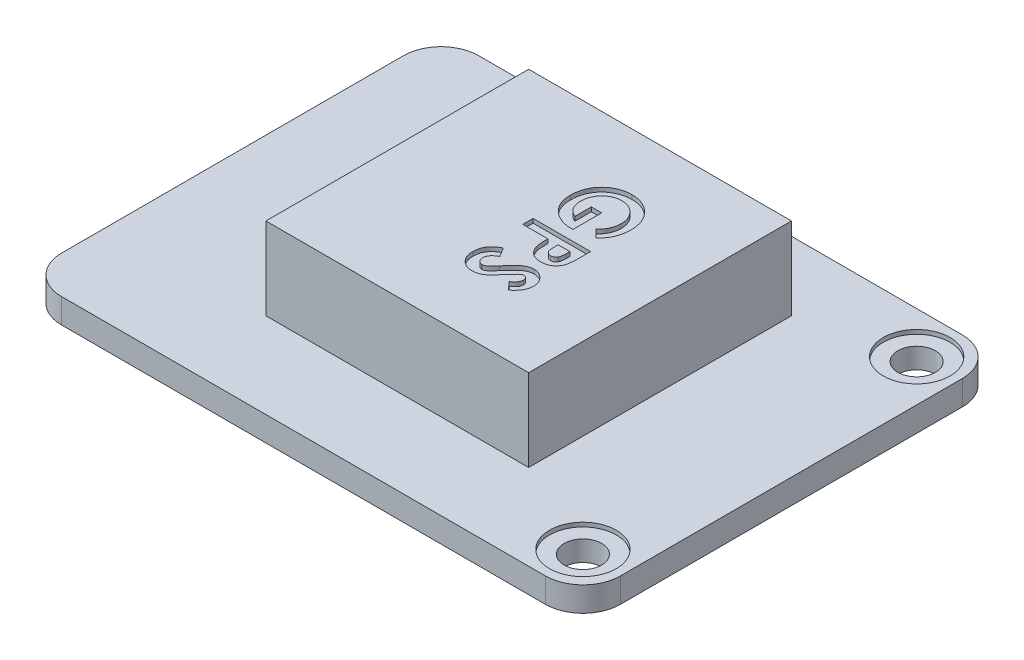
from build123d import *

# Parameters (mm, degrees)
SKETCH1_W           = 34.036
SKETCH1_H           = 25.4
SKETCH1_R           = 1.143
BOSS_EXTRUDE1_DEPTH = 1.5
CUT_EXTRUDE3_START  = -0.254
SKETCH2_R           = 2.032
SKETCH2_R_2         = 1.143
CUT_EXTRUDE3_DEPTH  = 0.254
SKETCH3_W           = 16
SKETCH3_H           = 16
BOSS_EXTRUDE2_DEPTH = 5
CUT_EXTRUDE4_DEPTH  = 0.254
FILLET1_R           = 2.286


with BuildPart() as part:
    # Sketch1 → Boss-Extrude1 (new body)
    with BuildSketch(Plane(origin=(0, 0, 0), x_dir=(1, 0, 0), z_dir=(0, 1, 0))):
        Rectangle(SKETCH1_W, SKETCH1_H)
        with Locations(Location((14.478, 10.16, 0), (0, 0, 270))):
            Circle(SKETCH1_R, mode=Mode.SUBTRACT)
        with Locations(Location((14.478, -10.16, 0), (0, 0, 270))):
            Circle(SKETCH1_R, mode=Mode.SUBTRACT)
    extrude(amount=BOSS_EXTRUDE1_DEPTH)

    # Sketch2 → Cut-Extrude3 (cut)
    # profile 1 of 2: a face of its own
    with BuildSketch(Plane(origin=(0, 1.5, 0), x_dir=(1, 0, 0), z_dir=(0, 1, 0)).offset(CUT_EXTRUDE3_START)):
        with Locations(Location((14.478, 10.16, 0), (0, 0, 270))):
            Circle(SKETCH2_R)
        with Locations(Location((14.478, 10.16, 0), (0, 0, 270))):
            Circle(SKETCH2_R_2, mode=Mode.SUBTRACT)
    # profile 2 of 2: a face of its own
    with BuildSketch(Plane(origin=(0, 1.5, 0), x_dir=(1, 0, 0), z_dir=(0, 1, 0)).offset(CUT_EXTRUDE3_START)):
        with Locations(Location((14.478, -10.16, 0), (0, 0, 270))):
            Circle(SKETCH2_R)
        with Locations(Location((14.478, -10.16, 0), (0, 0, 270))):
            Circle(SKETCH2_R_2, mode=Mode.SUBTRACT)
    extrude(amount=CUT_EXTRUDE3_DEPTH, mode=Mode.SUBTRACT)

    # Sketch3 → Boss-Extrude2 (add)
    with BuildSketch(Plane(origin=(0, 1.5, 0), x_dir=(1, 0, 0), z_dir=(0, 1, 0))):
        with Locations((0.508, 0.508)):
            Rectangle(SKETCH3_W, SKETCH3_H)
    extrude(amount=BOSS_EXTRUDE2_DEPTH)

    # Sketch4 → Cut-Extrude4 (cut)
    # profile 1 of 3: a face of its own
    with BuildSketch(Plane(origin=(0, 6.5, 0), x_dir=(1, 0, 0), z_dir=(0, 1, 0))):
        with BuildLine():
            Line((3.451309295, 1.652931891), (2.99628125, 2.128292468))
            add(Edge.make_bspline(
                [(2.99628125, 2.128292468), (3.03396147, 2.165927594), (3.107896282, 2.239773926), (3.204127521, 2.360540362), (3.285943098, 2.48561774), (3.353217589, 2.615417737), (3.405401533, 2.750121166), (3.442730378, 2.8894622), (3.464870748, 3.033667528), (3.467970324, 3.131288099), (3.469538462, 3.180676282)],
                knots=[0, 0, 0, 0, 1.075575784, 2.110457258, 3.113929901, 4.09197124, 5.059417775, 6.02750972, 7.002078037, 8, 8, 8, 8], degree=3))
            add(Edge.make_bspline(
                [(3.469538462, 3.180676282), (3.468439613, 3.223494281), (3.466281929, 3.307571176), (3.449898411, 3.431114858), (3.422525816, 3.549165409), (3.384621758, 3.662294649), (3.335238241, 3.769760102), (3.275491693, 3.872214844), (3.203887366, 3.968488072), (3.123311995, 4.058991397), (3.034674811, 4.141216945), (2.940619792, 4.213997927), (2.841354788, 4.275134567), (2.737444678, 4.325615086), (2.628684991, 4.363971918), (2.51521909, 4.391367373), (2.397359383, 4.408753263), (2.316954919, 4.410806279), (2.276229167, 4.411846154)],
                knots=[0, 0, 0, 0, 1.075079404, 2.111012651, 3.123248818, 4.114352675, 5.101852729, 6.0883232, 7.087285529, 8.109865155, 9.127328517, 10.119283532, 11.091685968, 12.049813832, 13.015105368, 13.981662908, 14.977689899, 16, 16, 16, 16], degree=3))
            add(Edge.make_bspline(
                [(2.276229167, 4.411846154), (2.234096416, 4.410869458), (2.151089131, 4.408945234), (2.02922704, 4.390687589), (1.912239482, 4.362066988), (1.799990092, 4.32200182), (1.692798007, 4.269771908), (1.59084415, 4.205465367), (1.493676598, 4.130032691), (1.402635336, 4.044129553), (1.318744746, 3.950646798), (1.246328446, 3.849432446), (1.184128268, 3.743644214), (1.134124338, 3.631567859), (1.094911007, 3.514632976), (1.066719758, 3.392098705), (1.049583238, 3.264364278), (1.047512463, 3.177223986), (1.046461538, 3.133)],
                knots=[0, 0, 0, 0, 1.022020332, 2.013519966, 2.983415422, 3.94151226, 4.900448282, 5.871487551, 6.861996943, 7.881274692, 8.905826162, 9.905469932, 10.896823527, 11.879375057, 12.878487611, 13.885682746, 14.926976999, 16, 16, 16, 16], degree=3))
            add(Edge.make_bspline(
                [(1.046461538, 3.133), (1.04672135, 3.104233387), (1.047231417, 3.047758124), (1.055499552, 2.96491676), (1.067337879, 2.885581359), (1.082947298, 2.809413645), (1.105332072, 2.73708419), (1.130663038, 2.667611384), (1.16204701, 2.601907759), (1.197662296, 2.539400703), (1.238681206, 2.480033544), (1.284919264, 2.423998067), (1.336797415, 2.371105646), (1.393321173, 2.320444942), (1.456141465, 2.273735971), (1.523701044, 2.229326529), (1.596748411, 2.187799504), (1.64832762, 2.163259684), (1.674666667, 2.150728365)],
                knots=[0, 0, 0, 0, 1.109467577, 2.178131716, 3.208562196, 4.204278576, 5.174223432, 6.127254264, 7.054993225, 7.9799672, 8.900446918, 9.835649638, 10.779420865, 11.756673556, 12.761211291, 13.796640546, 14.874849225, 16, 16, 16, 16], degree=3))
            Line((1.674666667, 2.150728365), (1.674666667, 3.155435897))
            Line((1.674666667, 3.155435897), (2.302871795, 3.155435897))
            Line((2.302871795, 3.155435897), (2.302871795, 1.41034375))
            Line((2.302871795, 1.41034375), (2.153532853, 1.405435897))
            add(Edge.make_bspline(
                [(2.153532853, 1.405435897), (2.115178823, 1.40606652), (2.03853921, 1.40732664), (1.924435882, 1.418842812), (1.811845899, 1.437919175), (1.700882342, 1.46399839), (1.591000895, 1.496682244), (1.483253766, 1.538364388), (1.376910248, 1.587173925), (1.272422219, 1.641861548), (1.172163115, 1.703314701), (1.077230978, 1.769478043), (0.987790116, 1.839408372), (0.905086663, 1.914626643), (0.828425875, 1.993961583), (0.758102674, 2.077569364), (0.694057559, 2.165745703), (0.635749495, 2.258023495), (0.584645917, 2.35492835), (0.540192583, 2.455927485), (0.502439306, 2.560868406), (0.471489831, 2.670022046), (0.447609849, 2.783173618), (0.431235314, 2.900325544), (0.420108633, 3.021542168), (0.418881282, 3.103760839), (0.41825641, 3.145620192)],
                knots=[0, 0, 0, 0, 1.006889344, 2.011981806, 3.007738725, 4.003571281, 5.003404394, 6.015442001, 7.03424805, 8.074616296, 9.110249922, 10.119753985, 11.111721717, 12.089233633, 13.052717867, 14.006597561, 14.955430184, 15.912305663, 16.870361111, 17.829300583, 18.807640451, 19.796414044, 20.806216501, 21.841577364, 22.90109906, 24, 24, 24, 24], degree=3))
            add(Edge.make_bspline(
                [(0.41825641, 3.145620192), (0.418879251, 3.190280241), (0.420113906, 3.278809779), (0.431466296, 3.409500295), (0.450659888, 3.536553165), (0.476364726, 3.659769811), (0.509517486, 3.779695085), (0.549722968, 3.895879148), (0.598926031, 4.007900834), (0.653734289, 4.116461444), (0.716490343, 4.220206489), (0.784847206, 4.319189543), (0.860285608, 4.412060136), (0.942034687, 4.499207136), (1.029383669, 4.581249833), (1.1235073, 4.657385346), (1.223496764, 4.728298445), (1.33001661, 4.792252403), (1.440158723, 4.850336314), (1.553274784, 4.900924959), (1.668487902, 4.943810196), (1.785823331, 4.978959535), (1.905278269, 5.00629839), (2.02678022, 5.026141143), (2.150519423, 5.037280894), (2.233673517, 5.03912372), (2.275528045, 5.040051282)],
                knots=[0, 0, 0, 0, 1.084269852, 2.149346245, 3.182248965, 4.202856654, 5.203774155, 6.201646532, 7.185249156, 8.172511953, 9.152555749, 10.126997366, 11.091273046, 12.05486384, 13.026475683, 13.998733638, 14.992239644, 16.000514163, 17.013329872, 18.014183023, 19.007154045, 19.996420909, 20.986208491, 21.980735032, 22.983629316, 24, 24, 24, 24], degree=3))
            add(Edge.make_bspline(
                [(2.275528045, 5.040051282), (2.332627147, 5.038811016), (2.445380945, 5.036361857), (2.611468005, 5.013678932), (2.772140663, 4.978319631), (2.926813761, 4.927575474), (3.075700363, 4.862458738), (3.219149986, 4.78389186), (3.357010157, 4.690168198), (3.44236475, 4.617619646), (3.485664263, 4.580816506)],
                knots=[0, 0, 0, 0, 1.034044851, 2.041932006, 3.031217818, 4.011390712, 4.986069675, 5.97149666, 6.970960976, 8, 8, 8, 8], degree=3))
            add(Edge.make_bspline(
                [(3.485664263, 4.580816506), (3.510714344, 4.557965797), (3.560438377, 4.512607482), (3.629530933, 4.440102298), (3.694480492, 4.365758362), (3.753909839, 4.288545999), (3.809119911, 4.2088711), (3.859075751, 4.126504347), (3.90536798, 4.041877816), (3.945632741, 3.954331523), (3.981733458, 3.864323786), (4.012279741, 3.771455973), (4.039336486, 3.676423646), (4.059919731, 3.57838529), (4.077059886, 3.478331326), (4.088548115, 3.375551539), (4.096968169, 3.270326009), (4.097483072, 3.199156753), (4.09774359, 3.163148237)],
                knots=[0, 0, 0, 0, 1.020590567, 2.025856924, 3.013483481, 3.991664875, 4.957826714, 5.930500614, 6.890802512, 7.860442893, 8.829981142, 9.809047939, 10.802672283, 11.803273349, 12.823572789, 13.857849586, 14.916166035, 16, 16, 16, 16], degree=3))
            add(Edge.make_bspline(
                [(4.09774359, 3.163148237), (4.097163107, 3.125507647), (4.09600816, 3.050616695), (4.088016678, 2.939266251), (4.075687706, 2.829463096), (4.057193543, 2.721669951), (4.034386391, 2.615525062), (4.005164785, 2.511577861), (3.971963776, 2.40915022), (3.945493479, 2.342470214), (3.932278846, 2.309181891)],
                knots=[0, 0, 0, 0, 1.03180557, 2.052914215, 3.058998889, 4.059601663, 5.049854447, 6.033765722, 7.018406786, 8, 8, 8, 8], degree=3))
            add(Edge.make_bspline(
                [(3.932278846, 2.309181891), (3.920066147, 2.281173885), (3.895225854, 2.224206376), (3.849779374, 2.141325671), (3.799396735, 2.058242466), (3.742235831, 1.97585327), (3.678403578, 1.894283623), (3.608908197, 1.812681849), (3.532939333, 1.73188097), (3.478871696, 1.679589066), (3.451309295, 1.652931891)],
                knots=[0, 0, 0, 0, 0.894392155, 1.819168899, 2.76525314, 3.739198753, 4.75366411, 5.797420238, 6.877176959, 8, 8, 8, 8], degree=3))
        make_face()
    # profile 2 of 3: a face of its own
    with BuildSketch(Plane(origin=(0, 6.5, 0), x_dir=(1, 0, 0), z_dir=(0, 1, 0))):
        with BuildLine():
            Line((4.008, 0.777230769), (4.008, 0.076108974))
            add(Edge.make_bspline(
                [(4.008, 0.076108974), (4.007794943, 0.030298586), (4.007399345, -0.058079256), (4.002602193, -0.185527375), (3.994005403, -0.303104505), (3.983381131, -0.410783633), (3.968486316, -0.508520484), (3.951410575, -0.596437454), (3.930607354, -0.674552787), (3.905914219, -0.74374735), (3.876801977, -0.805847235), (3.845795361, -0.864613756), (3.808790059, -0.918718781), (3.769774345, -0.970893157), (3.725021062, -1.018153983), (3.677508606, -1.063449673), (3.625352673, -1.10486183), (3.569184597, -1.142582344), (3.510042122, -1.176800662), (3.44781952, -1.206696074), (3.38241833, -1.230945558), (3.314261623, -1.25128786), (3.243352371, -1.267626995), (3.169254473, -1.278502843), (3.092485311, -1.285890266), (3.040236171, -1.286542104), (3.013809295, -1.286871795)],
                knots=[0, 0, 0, 0, 1.698747864, 3.27724071, 4.728299578, 6.070144658, 7.288476769, 8.393259625, 9.389771311, 10.283485332, 11.113357557, 11.931608583, 12.74405601, 13.541433047, 14.344816069, 15.154114104, 15.974336324, 16.810834471, 17.661136416, 18.50621059, 19.367396281, 20.244825668, 21.142564693, 22.063065223, 23.020325768, 24, 24, 24, 24], degree=3))
            add(Edge.make_bspline(
                [(3.013809295, -1.286871795), (2.984573024, -1.286396842), (2.927120158, -1.285463501), (2.842915743, -1.276244623), (2.762579804, -1.260651407), (2.685769193, -1.23977643), (2.612651774, -1.212548028), (2.543708506, -1.178421382), (2.478073132, -1.139386418), (2.416954824, -1.093299411), (2.360009751, -1.042390409), (2.306739923, -0.987509305), (2.258964682, -0.927412103), (2.215772686, -0.862936249), (2.176264008, -0.794615339), (2.140989999, -0.722136088), (2.110749431, -0.644986686), (2.094941061, -0.591256306), (2.086926282, -0.564015224)],
                knots=[0, 0, 0, 0, 1.101807132, 2.165186409, 3.188051288, 4.184043032, 5.162581952, 6.123956752, 7.080353552, 8.037115474, 9.004325744, 9.957633715, 10.916623919, 11.894012059, 12.880765509, 13.889456409, 14.929963055, 16, 16, 16, 16], degree=3))
            add(Edge.make_bspline(
                [(2.086926282, -0.564015224), (2.082462228, -0.546073003), (2.072791651, -0.507204375), (2.062973587, -0.442887471), (2.053946482, -0.368768993), (2.046188777, -0.284609265), (2.040915346, -0.19035977), (2.03679703, -0.086111764), (2.03380259, 0.028181996), (2.033696334, 0.107657357), (2.033641026, 0.149025641)],
                knots=[0, 0, 0, 0, 0.618981996, 1.340914327, 2.176866532, 3.120127938, 4.170906482, 5.338178032, 6.614476169, 8, 8, 8, 8], degree=3))
            Line((2.033641026, 0.149025641), (0.508, 0.149025641))
            Line((0.508, 0.149025641), (0.508, 0.777230769))
            Line((0.508, 0.777230769), (4.008, 0.777230769))
        make_face()
        with BuildLine():
            Line((2.661846154, 0.149025641), (2.661846154, -0.073229968))
            add(Edge.make_bspline(
                [(2.661846154, -0.073229968), (2.66210168, -0.113673498), (2.662571851, -0.188090195), (2.669405505, -0.289708606), (2.679797339, -0.371395962), (2.694818039, -0.435864747), (2.717198826, -0.486773995), (2.744146638, -0.530203065), (2.776578082, -0.568471043), (2.814813071, -0.601063538), (2.858323355, -0.627191885), (2.906840683, -0.645270089), (2.959262234, -0.657023939), (2.995747439, -0.658108776), (3.014510417, -0.658666667)],
                knots=[0, 0, 0, 0, 1.86206948, 3.426235505, 4.686422206, 5.652169143, 6.46188206, 7.235309636, 7.998714295, 8.762118954, 9.539132074, 10.32260217, 11.137376956, 12, 12, 12, 12], degree=3))
            add(Edge.make_bspline(
                [(3.014510417, -0.658666667), (3.030903138, -0.658114287), (3.062708959, -0.657042537), (3.108612649, -0.649169168), (3.151404356, -0.636621285), (3.19063718, -0.618439883), (3.226244457, -0.594935637), (3.258212159, -0.566279203), (3.287224904, -0.532838302), (3.302581793, -0.507019971), (3.310383814, -0.493903045)],
                knots=[0, 0, 0, 0, 1.102301479, 2.1387299, 3.123554645, 4.094223062, 5.036071848, 5.982632524, 6.975082478, 8, 8, 8, 8], degree=3))
            add(Edge.make_bspline(
                [(3.310383814, -0.493903045), (3.316002861, -0.482792251), (3.327899535, -0.459268425), (3.341730288, -0.419205067), (3.353398051, -0.372972565), (3.363082183, -0.320258795), (3.370598074, -0.261274049), (3.376345851, -0.196028851), (3.378657256, -0.124427185), (3.379405207, -0.074632511), (3.379794872, -0.048690705)],
                knots=[0, 0, 0, 0, 0.656809284, 1.390599849, 2.23162475, 3.173112763, 4.218524733, 5.370385145, 6.63003504, 8, 8, 8, 8], degree=3))
            Line((3.379794872, -0.048690705), (3.379794872, 0.149025641))
            Line((3.379794872, 0.149025641), (2.661846154, 0.149025641))
        make_face(mode=Mode.SUBTRACT)
    # profile 3 of 3: a face of its own
    with BuildSketch(Plane(origin=(0, 6.5, 0), x_dir=(1, 0, 0), z_dir=(0, 1, 0))):
        with BuildLine():
            Line((3.540351763, -3.754820513), (3.110564103, -3.28506891))
            add(Edge.make_bspline(
                [(3.110564103, -3.28506891), (3.13895355, -3.264950638), (3.19345733, -3.22632636), (3.266359505, -3.163657504), (3.328958469, -3.10136305), (3.379464445, -3.038169325), (3.420123347, -2.975164325), (3.448167431, -2.911009476), (3.46620275, -2.846442835), (3.468437647, -2.803041238), (3.469538462, -2.781663462)],
                knots=[0, 0, 0, 0, 1.299459705, 2.494781419, 3.587730629, 4.594196874, 5.512431013, 6.380462003, 7.202284646, 8, 8, 8, 8], degree=3))
            add(Edge.make_bspline(
                [(3.469538462, -2.781663462), (3.468839206, -2.761724559), (3.467489126, -2.723227777), (3.454069437, -2.668347757), (3.430909025, -2.619624495), (3.400624837, -2.577105541), (3.364139412, -2.543424256), (3.325875583, -2.516532361), (3.283640968, -2.501389965), (3.254632532, -2.499396928), (3.240271635, -2.498410256)],
                knots=[0, 0, 0, 0, 1.185010067, 2.2879431, 3.333075148, 4.379039566, 5.372662701, 6.27520591, 7.14612461, 8, 8, 8, 8], degree=3))
            add(Edge.make_bspline(
                [(3.240271635, -2.498410256), (3.225703647, -2.499028554), (3.196365745, -2.500273718), (3.153367395, -2.512300312), (3.111353002, -2.530427823), (3.085776842, -2.5477494), (3.072703526, -2.556603365)],
                knots=[0, 0, 0, 0, 0.967525499, 1.948461899, 2.951351359, 4, 4, 4, 4], degree=3))
            add(Edge.make_bspline(
                [(3.072703526, -2.556603365), (3.062542997, -2.564653755), (3.039154801, -2.583184689), (3.002078584, -2.618486781), (2.956963479, -2.662881711), (2.904056608, -2.717281245), (2.84404727, -2.781618642), (2.776584453, -2.856463305), (2.701244712, -2.940757801), (2.648709837, -3.000603997), (2.62118109, -3.031963942)],
                knots=[0, 0, 0, 0, 0.473868417, 1.090782513, 1.870421581, 2.78911798, 3.865477667, 5.087766164, 6.473963263, 8, 8, 8, 8], degree=3))
            add(Edge.make_bspline(
                [(2.62118109, -3.031963942), (2.595700826, -3.061405593), (2.54734458, -3.117279729), (2.478710653, -3.196777528), (2.416962381, -3.266642854), (2.363026476, -3.327893484), (2.316337026, -3.379600919), (2.276670855, -3.421982536), (2.244800191, -3.455555956), (2.225550291, -3.47464048), (2.217334936, -3.482785256)],
                knots=[0, 0, 0, 0, 1.543621617, 2.929473131, 4.163658386, 5.240097082, 6.164993805, 6.925417477, 7.541396219, 8, 8, 8, 8], degree=3))
            add(Edge.make_bspline(
                [(2.217334936, -3.482785256), (2.183906964, -3.513702458), (2.119646662, -3.573136177), (2.01976871, -3.650180551), (1.922935952, -3.714555026), (1.826173084, -3.763835066), (1.728317844, -3.799907236), (1.627685253, -3.826327315), (1.522548063, -3.841928487), (1.450826592, -3.843678806), (1.414550481, -3.844564103)],
                knots=[0, 0, 0, 0, 1.20648512, 2.3192881, 3.339983362, 4.284774958, 5.190427137, 6.099526693, 7.038756749, 8, 8, 8, 8], degree=3))
            add(Edge.make_bspline(
                [(1.414550481, -3.844564103), (1.379202336, -3.84393717), (1.309847959, -3.842707106), (1.208353453, -3.827657488), (1.11123681, -3.806166946), (1.019470997, -3.773052535), (0.931968315, -3.732352383), (0.84870008, -3.682748465), (0.771607478, -3.622103656), (0.698621099, -3.554741445), (0.633076816, -3.479080382), (0.57540722, -3.397671561), (0.526332175, -3.310666997), (0.487465072, -3.217742091), (0.456254487, -3.119465661), (0.434076558, -3.015713469), (0.420371824, -2.906364179), (0.418971708, -2.831718073), (0.41825641, -2.793582532)],
                knots=[0, 0, 0, 0, 1.043082113, 2.046565928, 3.024368146, 3.976196322, 4.921091788, 5.871642728, 6.831173094, 7.81279273, 8.801063391, 9.781590382, 10.755046466, 11.74476232, 12.751114423, 13.796272686, 14.874149815, 16, 16, 16, 16], degree=3))
            add(Edge.make_bspline(
                [(0.41825641, -2.793582532), (0.418787289, -2.763648203), (0.419838732, -2.704361064), (0.428428268, -2.616982027), (0.442277532, -2.532602927), (0.46217422, -2.451340943), (0.487155472, -2.372955312), (0.518243143, -2.297518895), (0.554833696, -2.225111569), (0.596947946, -2.155267102), (0.6458205, -2.08846691), (0.700435135, -2.023812922), (0.761975734, -1.962112703), (0.829242085, -1.902100779), (0.903958061, -1.845899073), (0.983968363, -1.790625908), (1.071159112, -1.738956787), (1.132312887, -1.707026984), (1.163548878, -1.690717949)],
                knots=[0, 0, 0, 0, 1.016957334, 2.014158747, 2.980235577, 3.920141478, 4.854360818, 5.773095257, 6.689355356, 7.608638744, 8.541033765, 9.498850575, 10.481527934, 11.499755671, 12.559141621, 13.65604909, 14.802761907, 16, 16, 16, 16], degree=3))
            Line((1.163548878, -1.690717949), (1.495179487, -2.243201923))
            add(Edge.make_bspline(
                [(1.495179487, -2.243201923), (1.459721473, -2.263600734), (1.39174543, -2.302706997), (1.300411001, -2.368976216), (1.222198182, -2.436865648), (1.158489388, -2.507944836), (1.108432751, -2.581349483), (1.072658806, -2.65743415), (1.050514774, -2.736252294), (1.047810476, -2.789939633), (1.046461538, -2.816719551)],
                knots=[0, 0, 0, 0, 1.283663364, 2.460892379, 3.537111102, 4.529833553, 5.449777664, 6.316464042, 7.160231139, 8, 8, 8, 8], degree=3))
            add(Edge.make_bspline(
                [(1.046461538, -2.816719551), (1.047552686, -2.843963579), (1.049669671, -2.896820959), (1.069609526, -2.972392311), (1.100214573, -3.041982645), (1.144724908, -3.101812659), (1.195479637, -3.152619843), (1.252722978, -3.189043373), (1.313915402, -3.212670044), (1.356616129, -3.215124516), (1.378092147, -3.216358974)],
                knots=[0, 0, 0, 0, 1.13537643, 2.202795631, 3.242191317, 4.290390765, 5.297919085, 6.223733717, 7.106639842, 8, 8, 8, 8], degree=3))
            add(Edge.make_bspline(
                [(1.378092147, -3.216358974), (1.39806206, -3.215203486), (1.438629027, -3.212856221), (1.498980599, -3.195661087), (1.559039529, -3.168554277), (1.60882286, -3.137446028), (1.650319337, -3.105014003), (1.685733524, -3.073224406), (1.725678627, -3.035548235), (1.769065386, -2.991025481), (1.81672799, -2.940522103), (1.868553117, -2.883872765), (1.924118315, -2.820467405), (1.961967234, -2.775650571), (1.981758013, -2.752216346)],
                knots=[0, 0, 0, 0, 0.916057066, 1.860882232, 2.859899639, 3.934694552, 4.546382938, 5.276161949, 6.118633209, 7.067046139, 8.129668089, 9.306861125, 10.591787583, 12, 12, 12, 12], degree=3))
            add(Edge.make_bspline(
                [(1.981758013, -2.752216346), (2.019452162, -2.707668657), (2.091798643, -2.622168159), (2.198630538, -2.501322939), (2.298550577, -2.392508471), (2.392351681, -2.296441384), (2.479455154, -2.212865491), (2.55903123, -2.140768523), (2.632694295, -2.081720386), (2.720090478, -2.019646023), (2.826029157, -1.959719195), (2.954164767, -1.908890074), (3.082010977, -1.875728133), (3.167866123, -1.872026865), (3.210123397, -1.870205128)],
                knots=[0, 0, 0, 0, 1.34561873, 2.582649632, 3.719171478, 4.751946187, 5.678152813, 6.502542634, 7.227205346, 7.853698961, 8.973370308, 10.023159194, 11.027013428, 12, 12, 12, 12], degree=3))
            add(Edge.make_bspline(
                [(3.210123397, -1.870205128), (3.240087944, -1.870965547), (3.299121319, -1.872463653), (3.38593124, -1.885787893), (3.46965684, -1.905792991), (3.550272631, -1.934545555), (3.62688647, -1.973095932), (3.700677338, -2.018685039), (3.771516651, -2.072253895), (3.837094628, -2.134430555), (3.898013225, -2.201880854), (3.951486029, -2.274123463), (3.996457814, -2.350404052), (4.034311445, -2.430183035), (4.062799585, -2.514485636), (4.083173568, -2.602545706), (4.095259586, -2.694388616), (4.096905273, -2.756854433), (4.09774359, -2.788674679)],
                knots=[0, 0, 0, 0, 1.010961173, 1.991702108, 2.958025473, 3.913824419, 4.873522744, 5.847800578, 6.838738273, 7.865764422, 8.893759806, 9.903642949, 10.894078012, 11.878777586, 12.879248405, 13.891624672, 14.925988217, 16, 16, 16, 16], degree=3))
            add(Edge.make_bspline(
                [(4.09774359, -2.788674679), (4.096230948, -2.829910513), (4.093217606, -2.91205668), (4.069778288, -3.033548684), (4.03252557, -3.152273084), (3.988652966, -3.248247193), (3.944776935, -3.323937432), (3.905264747, -3.382141562), (3.859717345, -3.441482878), (3.807953191, -3.502267199), (3.750317998, -3.564185624), (3.685639739, -3.626717153), (3.616026673, -3.691385064), (3.566018635, -3.733304933), (3.540351763, -3.754820513)],
                knots=[0, 0, 0, 0, 1.282867522, 2.555608537, 3.83715526, 5.14906667, 5.830341525, 6.558732832, 7.337173124, 8.157810814, 9.043130442, 9.96912168, 10.957641678, 12, 12, 12, 12], degree=3))
        make_face()
    extrude(amount=-CUT_EXTRUDE4_DEPTH, mode=Mode.SUBTRACT)

    # Fillet1
    fillet1_edges = [part.edges().sort_by_distance(p)[0] for p in [
        (17.018, 0.75, 12.7),
        (-17.018, 0.75, 12.7),
        (-17.018, 0.75, -12.7),
        (17.018, 0.75, -12.7),
    ]]
    fillet(fillet1_edges, radius=FILLET1_R)


solid = part.part
